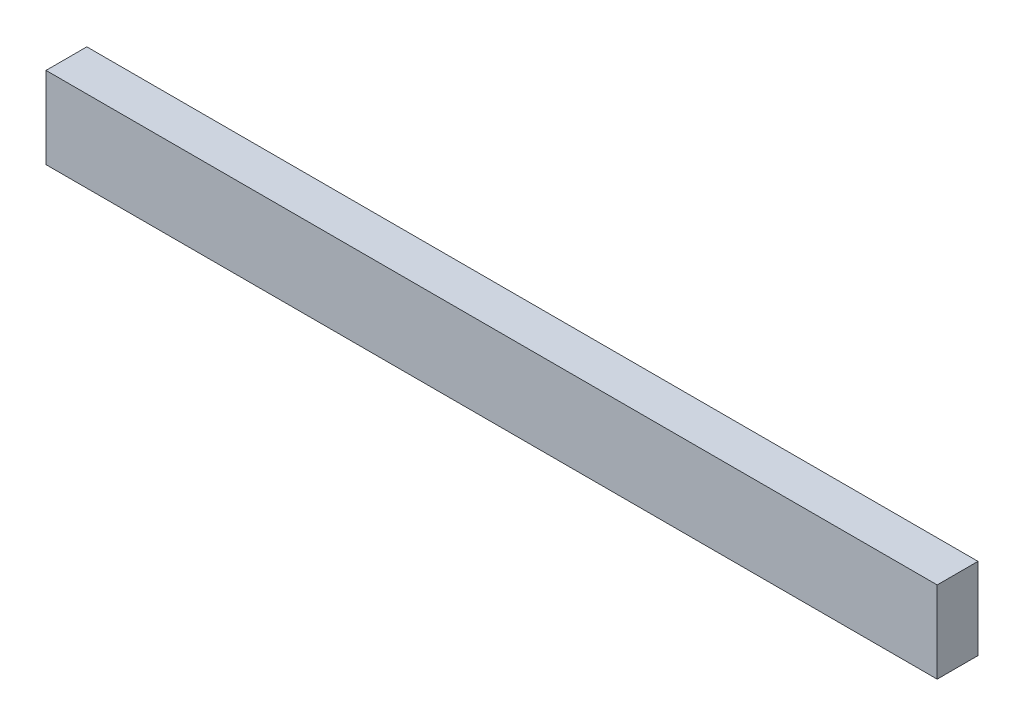
from build123d import *

# Parameters (mm, degrees)
ESQUISSE1_W        = 524
ESQUISSE1_H        = 48
BOSS_EXTRU_1_DEPTH = 12


with BuildPart() as part:
    # Esquisse1 → Boss.-Extru.1 (new, symmetric)
    with BuildSketch(Plane.XY):
        Rectangle(ESQUISSE1_W, ESQUISSE1_H)
    extrude(amount=BOSS_EXTRU_1_DEPTH, both=True)


solid = part.part
